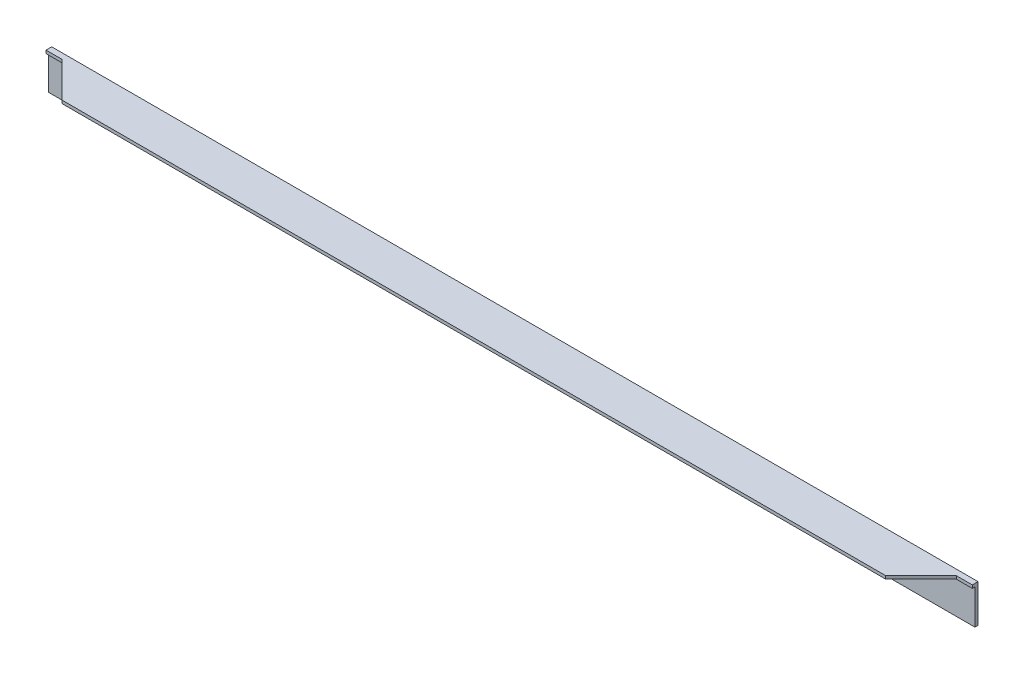
from build123d import *

# Parameters (mm, degrees)
SKETCH_1_W          = 2440
SKETCH_1_H          = 100
EXTRUDE_678_DEPTH   = 8
SKETCH_2_W          = 2440
SKETCH_2_H          = 8
EXTRUDE_1_DEPTH     = 100
CUT_EXTRUDE_1_DEPTH = 1229.846613699


with BuildPart() as part:
    # 草图1 → Extrude 678 (new body)
    with BuildSketch(Plane.XY):
        with Locations((0, 50)):
            Rectangle(SKETCH_1_W, SKETCH_1_H)
    extrude(amount=EXTRUDE_678_DEPTH)

    # 草图2 → 凸台-拉伸1 (add)
    with BuildSketch(Plane.XY.offset(8)):
        with Locations((0, 96)):
            Rectangle(SKETCH_2_W, SKETCH_2_H)
    extrude(amount=EXTRUDE_1_DEPTH)

    # 草图3 → 切除-拉伸1 (cut, through all)
    with BuildSketch(Plane(origin=(0, 100, 0), x_dir=(-1, 0, 0), z_dir=(0, 1, 0))):
        Polygon((-1085, 108), (-1178, 15), (-1220, 15), (-1220, 108), align=None)
        Polygon((1220, 15), (1178, 15), (1085, 108), (1220, 108), align=None)
    extrude(amount=-CUT_EXTRUDE_1_DEPTH, mode=Mode.SUBTRACT)


solid = part.part
